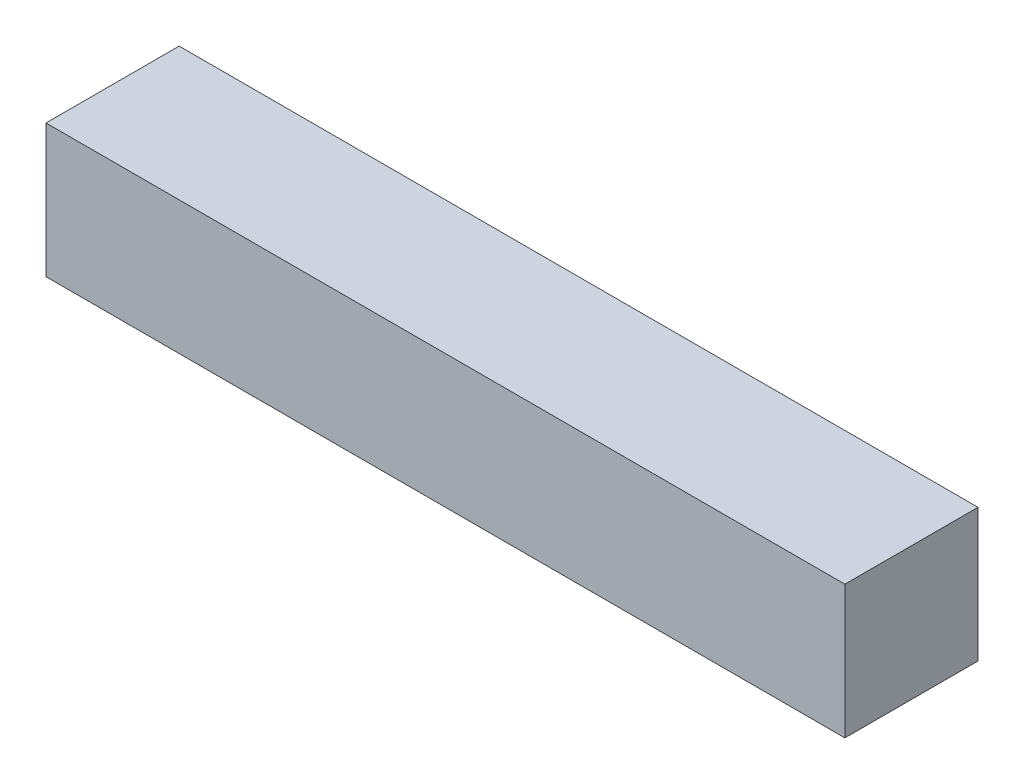
from build123d import *

# Parameters (mm, degrees)
SKETCH1_W           = 25.4
SKETCH1_H           = 25.4
BOSS_EXTRUDE1_DEPTH = 152.4


with BuildPart() as part:
    # Sketch1 → Boss-Extrude1 (new body)
    with BuildSketch(Plane(origin=(0, 0, 0), x_dir=(0, 0, -1), z_dir=(1, 0, 0))):
        with Locations((12.7, -12.7)):
            Rectangle(SKETCH1_W, SKETCH1_H)
    extrude(amount=BOSS_EXTRUDE1_DEPTH)


solid = part.part
